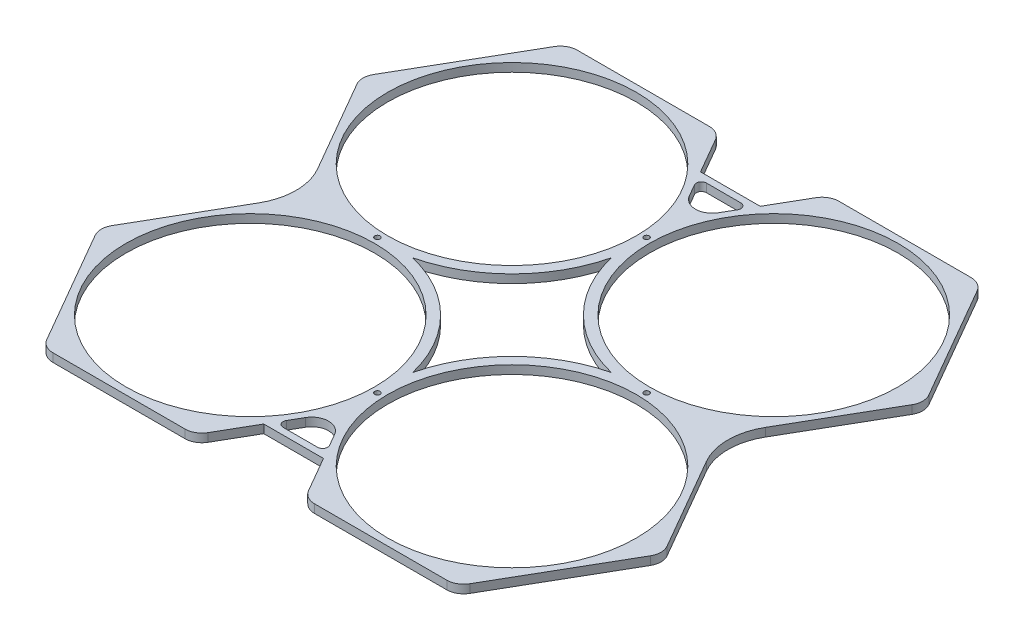
from build123d import *

# Parameters (mm, degrees)
SKETCH_7_R          = 73.9
EXTRUDE_1_DEPTH     = 5
CUT_EXTRUDE_1_REACH = 229.923
SKETCH_8_R          = 1.6


with BuildPart() as part:
    # 草图7 → 凸台-拉伸1 (new body)
    with BuildSketch(Plane(origin=(0, 0, 0), x_dir=(1, 0, 0), z_dir=(0, 1, 0))):
        with BuildLine():
            Line((29.861673588, 150.781745931), (17.737317935, 129.781745931))
            Line((17.737317935, 129.781745931), (-17.737317935, 129.781745931))
            Line((-17.737317935, 129.781745931), (-29.861673588, 150.781745931))
            ThreePointArc((-29.861673588, 150.781745931), (-33.521927626, 154.441999968), (-38.521927626, 155.781745931))
            Line((-38.521927626, 155.781745931), (-117.041564235, 155.781745931))
            ThreePointArc((-117.041564235, 155.781745931), (-122.041564235, 154.441999968), (-125.701818273, 150.781745931))
            Line((-125.701818273, 150.781745931), (-164.961636578, 82.781745931))
            ThreePointArc((-164.961636578, 82.781745931), (-166.30138254, 77.781745931), (-164.961636578, 72.781745931))
            Line((-164.961636578, 72.781745931), (-133.044705684, 17.5))
            ThreePointArc((-133.044705684, 17.5), (-128.355594816, 0), (-133.044705684, -17.5))
            Line((-133.044705684, -17.5), (-164.961636578, -72.781745931))
            ThreePointArc((-164.961636578, -72.781745931), (-166.30138254, -77.781745931), (-164.961636578, -82.781745931))
            Line((-164.961636578, -82.781745931), (-125.701818273, -150.781745931))
            ThreePointArc((-125.701818273, -150.781745931), (-122.041564235, -154.441999968), (-117.041564235, -155.781745931))
            Line((-117.041564235, -155.781745931), (-38.521927626, -155.781745931))
            ThreePointArc((-38.521927626, -155.781745931), (-33.521927626, -154.441999968), (-29.861673588, -150.781745931))
            Line((-29.861673588, -150.781745931), (-17.737317935, -129.781745931))
            Line((-17.737317935, -129.781745931), (17.737317935, -129.781745931))
            Line((17.737317935, -129.781745931), (29.861673588, -150.781745931))
            ThreePointArc((29.861673588, -150.781745931), (33.521927626, -154.441999968), (38.521927626, -155.781745931))
            Line((38.521927626, -155.781745931), (117.041564235, -155.781745931))
            ThreePointArc((117.041564235, -155.781745931), (122.041564235, -154.441999968), (125.701818273, -150.781745931))
            Line((125.701818273, -150.781745931), (164.961636578, -82.781745931))
            ThreePointArc((164.961636578, -82.781745931), (166.30138254, -77.781745931), (164.961636578, -72.781745931))
            Line((164.961636578, -72.781745931), (133.044705684, -17.5))
            ThreePointArc((133.044705684, -17.5), (128.355594816, 0), (133.044705684, 17.5))
            Line((133.044705684, 17.5), (164.961636578, 72.781745931))
            ThreePointArc((164.961636578, 72.781745931), (166.30138254, 77.781745931), (164.961636578, 82.781745931))
            Line((164.961636578, 82.781745931), (125.701818273, 150.781745931))
            ThreePointArc((125.701818273, 150.781745931), (122.041564235, 154.441999968), (117.041564235, 155.781745931))
            Line((117.041564235, 155.781745931), (38.521927626, 155.781745931))
            ThreePointArc((38.521927626, 155.781745931), (33.521927626, 154.441999968), (29.861673588, 150.781745931))
        make_face()
        with Locations((-77.781745931, -77.781745931)):
            Circle(SKETCH_7_R, mode=Mode.SUBTRACT)
        with BuildLine():
            Line((8.660254038, -114.059810077), (12.829840647, -121.281745931))
            ThreePointArc((12.829840647, -121.281745931), (12.829840647, -124.281745931), (10.231764435, -125.781745931))
            Line((10.231764435, -125.781745931), (-10.231764435, -125.781745931))
            ThreePointArc((-10.231764435, -125.781745931), (-12.829840647, -124.281745931), (-12.829840647, -121.281745931))
            Line((-12.829840647, -121.281745931), (-8.660254038, -114.059810077))
            ThreePointArc((-8.660254038, -114.059810077), (0, -109.059810077), (8.660254038, -114.059810077))
        make_face(mode=Mode.SUBTRACT)
        with Locations((77.781745931, -77.781745931)):
            Circle(SKETCH_7_R, mode=Mode.SUBTRACT)
        with Locations((-77.781745931, 77.781745931)):
            Circle(SKETCH_7_R, mode=Mode.SUBTRACT)
        with Locations((77.781745931, 77.781745931)):
            Circle(SKETCH_7_R, mode=Mode.SUBTRACT)
        with BuildLine():
            Line((-10.231764435, 125.781745931), (10.231764435, 125.781745931))
            ThreePointArc((10.231764435, 125.781745931), (12.829840647, 124.281745931), (12.829840647, 121.281745931))
            Line((12.829840647, 121.281745931), (8.660254038, 114.059810077))
            ThreePointArc((8.660254038, 114.059810077), (0, 109.059810077), (-8.660254038, 114.059810077))
            Line((-8.660254038, 114.059810077), (-12.829840647, 121.281745931))
            ThreePointArc((-12.829840647, 121.281745931), (-12.829840647, 124.281745931), (-10.231764435, 125.781745931))
        make_face(mode=Mode.SUBTRACT)
    extrude(amount=EXTRUDE_1_DEPTH)

    # 草图8 → 切除-拉伸1 (cut, up to next)
    with BuildSketch(Plane(origin=(0, 5, 0), x_dir=(1, 0, 0), z_dir=(0, 1, 0)), mode=Mode.PRIVATE) as cut_extrude_1_sk1:
        with Locations((80, 0)):
            Circle(SKETCH_8_R)
    cut_extrude_1_tool1 = extrude(cut_extrude_1_sk1.sketch, amount=-CUT_EXTRUDE_1_REACH, mode=Mode.PRIVATE) & part.part
    # 草图8 → 切除-拉伸1 (cut, up to next)
    with BuildSketch(Plane(origin=(0, 5, 0), x_dir=(1, 0, 0), z_dir=(0, 1, 0)), mode=Mode.PRIVATE) as cut_extrude_1_sk2:
        with Locations((0, -80)):
            Circle(SKETCH_8_R)
    cut_extrude_1_tool2 = extrude(cut_extrude_1_sk2.sketch, amount=-CUT_EXTRUDE_1_REACH, mode=Mode.PRIVATE) & part.part
    # 草图8 → 切除-拉伸1 (cut, up to next)
    with BuildSketch(Plane(origin=(0, 5, 0), x_dir=(1, 0, 0), z_dir=(0, 1, 0)), mode=Mode.PRIVATE) as cut_extrude_1_sk3:
        with Locations((-80, 0)):
            Circle(SKETCH_8_R)
    cut_extrude_1_tool3 = extrude(cut_extrude_1_sk3.sketch, amount=-CUT_EXTRUDE_1_REACH, mode=Mode.PRIVATE) & part.part
    # 草图8 → 切除-拉伸1 (cut, up to next)
    with BuildSketch(Plane(origin=(0, 5, 0), x_dir=(1, 0, 0), z_dir=(0, 1, 0)), mode=Mode.PRIVATE) as cut_extrude_1_sk4:
        with Locations((0, 80)):
            Circle(SKETCH_8_R)
    cut_extrude_1_tool4 = extrude(cut_extrude_1_sk4.sketch, amount=-CUT_EXTRUDE_1_REACH, mode=Mode.PRIVATE) & part.part
    # 草图8 → 切除-拉伸1 (cut, up to next)
    with BuildSketch(Plane(origin=(0, 5, 0), x_dir=(1, 0, 0), z_dir=(0, 1, 0)), mode=Mode.PRIVATE) as cut_extrude_1_sk5:
        with BuildLine():
            ThreePointArc((59.073458997, 0), (21.213203436, 21.213203436), (0, 59.073458997))
            ThreePointArc((0, 59.073458997), (-21.213203436, 21.213203436), (-59.073458997, 0))
            ThreePointArc((-59.073458997, 0), (-21.213203436, -21.213203436), (0, -59.073458997))
            ThreePointArc((0, -59.073458997), (21.213203436, -21.213203436), (59.073458997, 0))
        make_face()
    cut_extrude_1_tool5 = extrude(cut_extrude_1_sk5.sketch, amount=-CUT_EXTRUDE_1_REACH, mode=Mode.PRIVATE) & part.part
    add(cut_extrude_1_tool1.solids().sort_by_distance((80, 5, 0))[0], mode=Mode.SUBTRACT)
    add(cut_extrude_1_tool2.solids().sort_by_distance((0, 5, 80))[0], mode=Mode.SUBTRACT)
    add(cut_extrude_1_tool3.solids().sort_by_distance((-80, 5, 0))[0], mode=Mode.SUBTRACT)
    add(cut_extrude_1_tool4.solids().sort_by_distance((0, 5, -80))[0], mode=Mode.SUBTRACT)
    add(cut_extrude_1_tool5.solids().sort_by_distance((0, 5, 0))[0], mode=Mode.SUBTRACT)


solid = part.part
